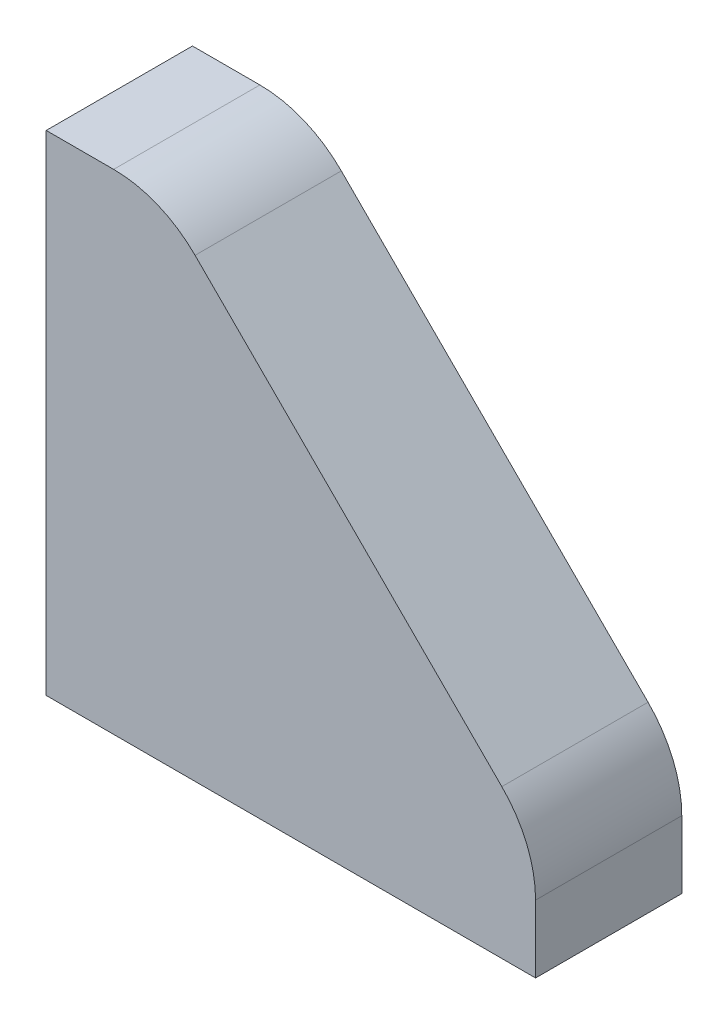
from build123d import *

# Parameters (mm, degrees)
BOSS_EXTRUDE1_DEPTH = 12.7
FILLET1_R           = 20


with BuildPart() as part:
    # Sketch1 → Boss-Extrude1 (new, symmetric)
    with BuildSketch(Plane.XY):
        Polygon((0, 0), (85, 0), (85, 20), (20, 85), (0, 85), align=None)
    extrude(amount=BOSS_EXTRUDE1_DEPTH, both=True)

    # Fillet1
    fillet1_edges = [part.edges().sort_by_distance(p)[0] for p in [
        (20, 85, 0),
        (85, 20, 0),
    ]]
    fillet(fillet1_edges, radius=FILLET1_R)


solid = part.part
